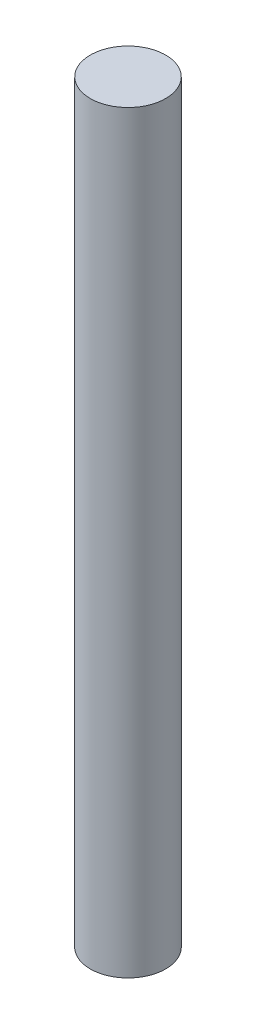
from build123d import *

# Parameters (mm, degrees)
SKETCH1_R           = 50
BOSS_EXTRUDE1_DEPTH = 1000


with BuildPart() as part:
    # Sketch1 → Boss-Extrude1 (new body)
    with BuildSketch(Plane(origin=(0, 0, 0), x_dir=(1, 0, 0), z_dir=(0, 1, 0))):
        with Locations(Location((0, 0, 0), (0, 0, 270))):
            Circle(SKETCH1_R)
    extrude(amount=BOSS_EXTRUDE1_DEPTH)


solid = part.part
